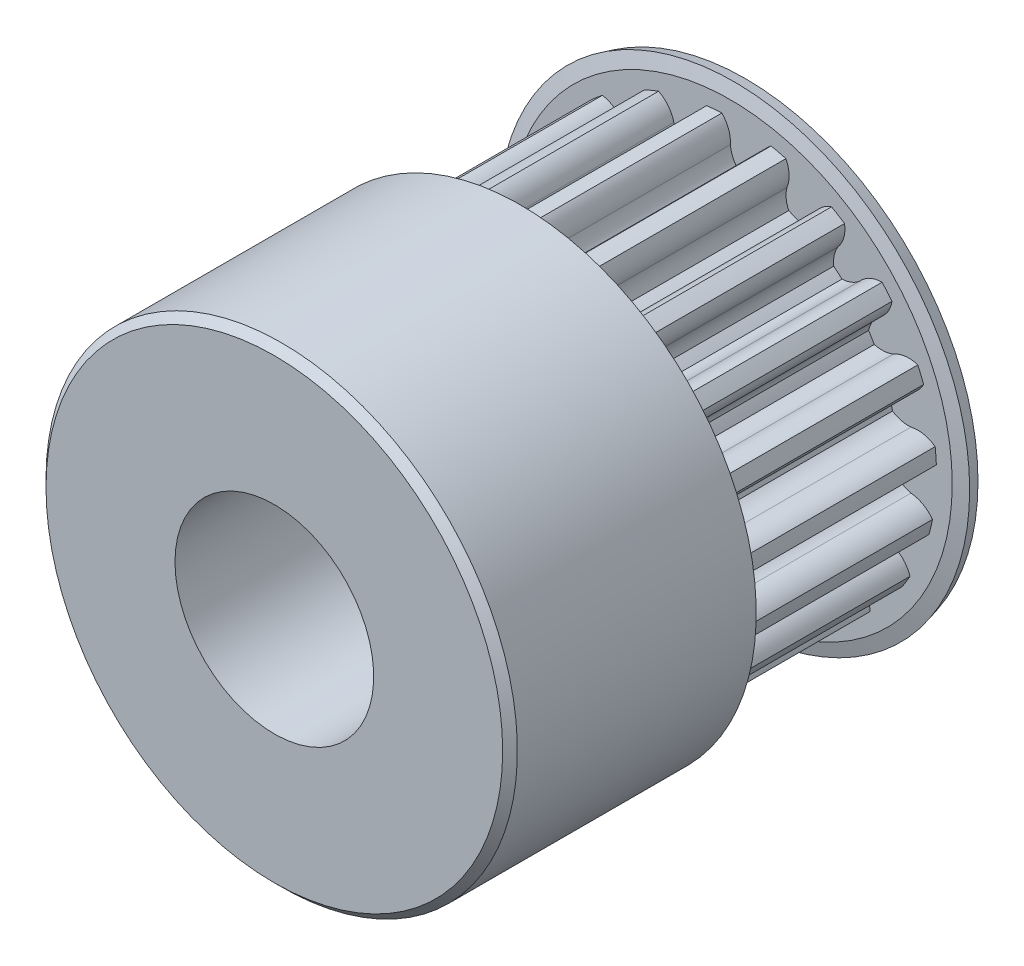
from build123d import *

# Parameters (mm, degrees)
SKETCH1_R           = 7
BOSS_EXTRUDE1_DEPTH = 7
CUT_EXTRUDE1_START  = -7
CUT_EXTRUDE1_DEPTH  = 7
CIRPATTERN1_COUNT   = 20
SKETCH3_R           = 2.5
CUT_EXTRUDE2_DEPTH  = 7


with BuildPart() as part:
    # Sketch1 → Boss-Extrude1 (new body)
    with BuildSketch(Plane.XY):
        Circle(SKETCH1_R)
    extrude(amount=BOSS_EXTRUDE1_DEPTH)

    # Sketch2 → Cut-Extrude1 (cut)
    with BuildSketch(Plane.XY.offset(7).offset(CUT_EXTRUDE1_START)):
        with BuildLine():
            ThreePointArc((0.972302791, 6.1312752), (1.096934983, 6.541731598), (1.382072919, 6.862206238))
            ThreePointArc((1.382072919, 6.862206238), (0.549882168, 6.978368692), (-0.290231769, 6.993980663))
            ThreePointArc((-0.290231769, 6.993980663), (-0.058806828, 6.632801852), (0, 6.207890809))
            ThreePointArc((0, 6.207890809), (0.07898528, 5.889690377), (0.256638442, 5.614137219))
            ThreePointArc((0.256638442, 5.614137219), (0.441476826, 5.60263315), (0.62583581, 5.585045169))
            ThreePointArc((0.62583581, 5.585045169), (0.844454593, 5.829372853), (0.972302791, 6.1312752))
        make_face()
    cut_extrude1 = extrude(amount=CUT_EXTRUDE1_DEPTH, mode=Mode.SUBTRACT)

    # CirPattern1: Cut-Extrude1 ×20 about axis
    cirpattern1_axis = Axis((0, 0, 0), (0, 0, 1))
    for i in range(1, CIRPATTERN1_COUNT):
        add(cut_extrude1.rotate(cirpattern1_axis, i * 360 / CIRPATTERN1_COUNT), mode=Mode.SUBTRACT)

    # Sketch3 → Cut-Extrude2 (cut)
    with BuildSketch(Plane.XY.offset(7)):
        Circle(SKETCH3_R)
    extrude(amount=-CUT_EXTRUDE2_DEPTH, mode=Mode.SUBTRACT)

    # Sketch4 → Revolve3 (revolve)
    with BuildSketch(Plane(origin=(0, 0, 0), x_dir=(0, 0, -1), z_dir=(1, 0, 0)), mode=Mode.PRIVATE) as revolve3_sk:
        Polygon((0, -7.532770955), (0.125193645, -8), (0.511563976, -7.896472382), (0.4, -7.480109956), (0.4, -2.498650108), (0, -2.498650108), align=None)
    revolve(revolve3_sk.sketch.rotate(Axis((0, 0, 0), (0, 0, -1)), 270), axis=Axis((0, 0, 0), (0, 0, -1)))

    # Sketch7 → Revolve4 (revolve)
    with BuildSketch(Plane(origin=(0, 0, 0), x_dir=(0, 0, -1), z_dir=(1, 0, 0)), mode=Mode.PRIVATE) as revolve4_sk:
        Polygon((-7, 3.370594433), (-7, 7.532770955), (-7.125193645, 8), (-15.235193645, 8), (-15.485193645, 7.75), (-15.485193645, 3.370594433), align=None)
    revolve(revolve4_sk.sketch.rotate(Axis((0, -0.003090187, 7), (0, 0, 1)), 90), axis=Axis((0, -0.003090187, 7), (0, 0, 1)))


solid = part.part
